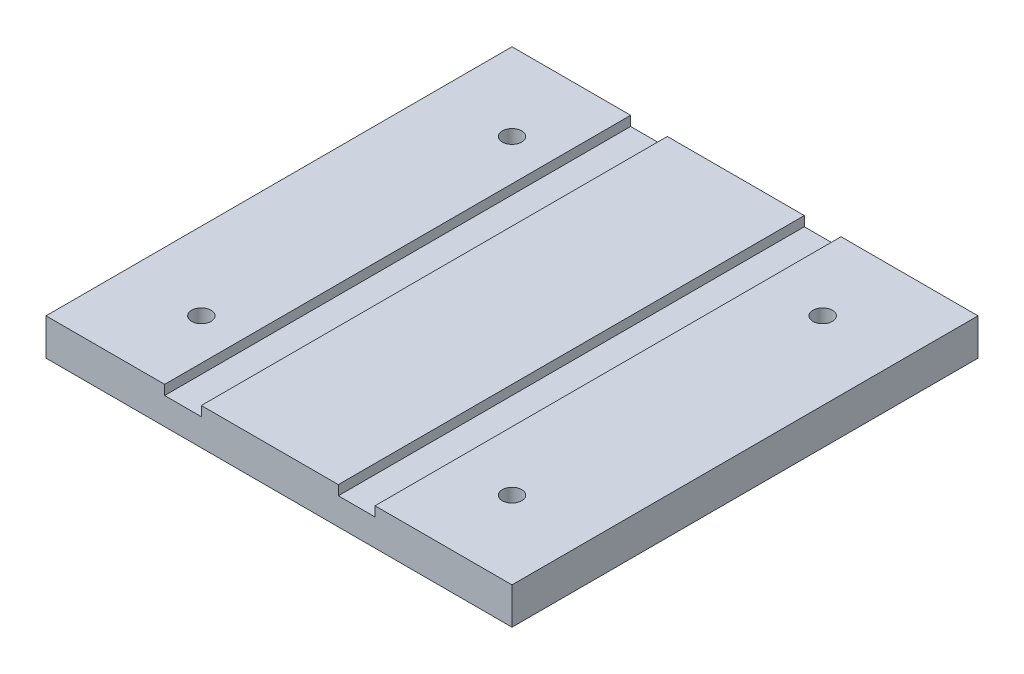
from build123d import *

# Parameters (mm, degrees)
SKETCH1_W           = 152.4
SKETCH1_H           = 152.4
SKETCH1_R           = 3.175
BOSS_EXTRUDE1_DEPTH = 12
SKETCH2_W           = 12.0000014
SKETCH2_H           = 152.4
CUT_EXTRUDE1_DEPTH  = 3.175


with BuildPart() as part:
    # Sketch1 → Boss-Extrude1 (new body)
    with BuildSketch(Plane(origin=(0, 0, 0), x_dir=(1, 0, 0), z_dir=(0, 1, 0))):
        Rectangle(SKETCH1_W, SKETCH1_H)
        with Locations(Location((-50.8, 50.8, 0), (0, 0, 270))):
            Circle(SKETCH1_R, mode=Mode.SUBTRACT)
        with Locations(Location((50.8, 50.8, 0), (0, 0, 270))):
            Circle(SKETCH1_R, mode=Mode.SUBTRACT)
        with Locations(Location((-50.8, -50.8, 0), (0, 0, 270))):
            Circle(SKETCH1_R, mode=Mode.SUBTRACT)
        with Locations(Location((50.8, -50.8, 0), (0, 0, 270))):
            Circle(SKETCH1_R, mode=Mode.SUBTRACT)
    extrude(amount=BOSS_EXTRUDE1_DEPTH)

    # Sketch2 → Cut-Extrude1 (cut)
    with BuildSketch(Plane(origin=(0, 12, 0), x_dir=(1, 0, 0), z_dir=(0, 1, 0))):
        with Locations((-31.4000007, 0)):
            Rectangle(SKETCH2_W, SKETCH2_H)
        with Locations((25.4, 0)):
            Rectangle(SKETCH2_W, SKETCH2_H)
    extrude(amount=-CUT_EXTRUDE1_DEPTH, mode=Mode.SUBTRACT)


solid = part.part
